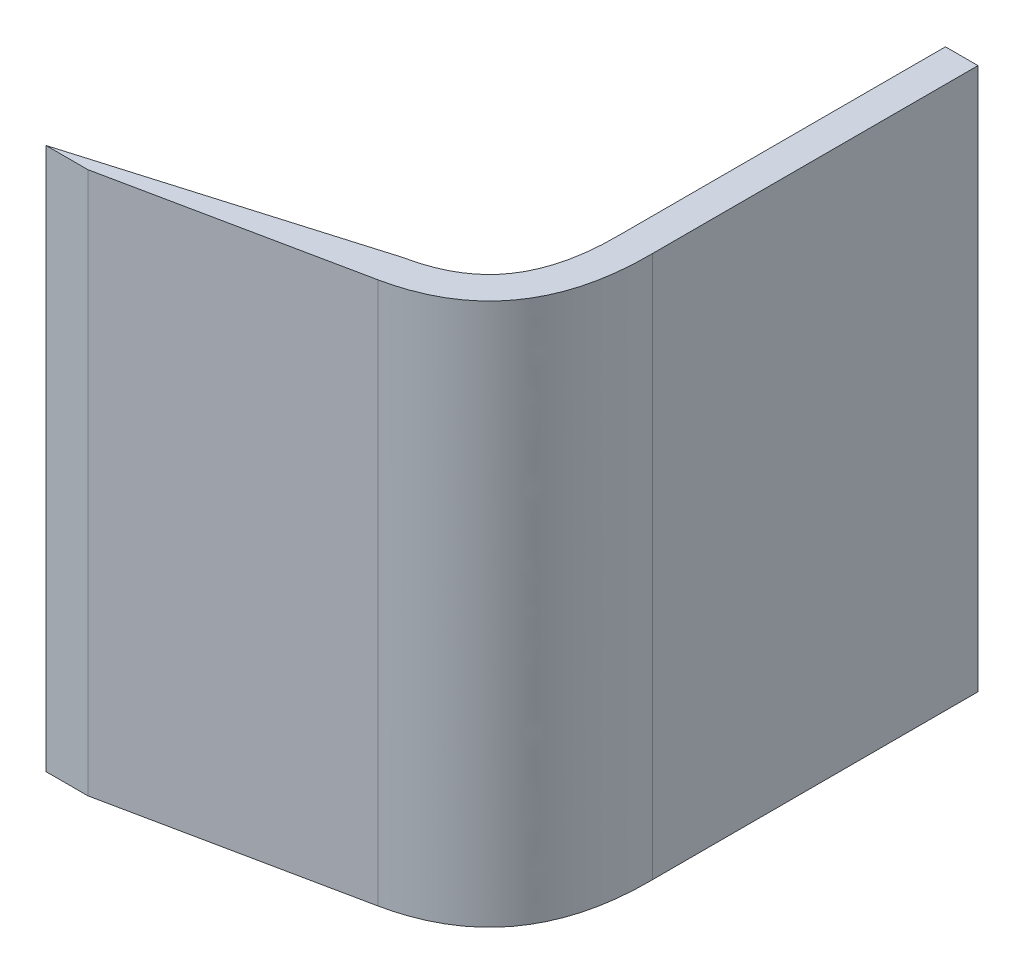
from build123d import *

# Parameters (mm, degrees)
BOSS_EXTRUDE1_DEPTH = 50


with BuildPart() as part:
    # Sketch1 → Boss-Extrude1 (new body)
    with BuildSketch(Plane(origin=(0, 0, 0), x_dir=(1, 0, 0), z_dir=(0, 1, 0))):
        Polygon((0, 30), (0, 0), (0.000186337, -0.03343628), (3, 0), (3, 30), align=None)
        with BuildLine():
            Line((0.000186337, -0.03343628), (3, 0))
            add(Edge.make_bspline(
                [(3, 0), (3.139918652, -12.553127515), (-7.554025616, -14.764008615)],
                knots=[0, 0, 0, 1, 1, 1], degree=2))
            Line((-7.554025616, -14.764008615), (-29.724787296, -19.341198123))
            Line((-29.724787296, -19.341198123), (-33.586790943, -19.341198123))
            Line((-33.586790943, -19.341198123), (-8.16140534, -11.826136958))
            add(Edge.make_bspline(
                [(0.000186337, -0.03343628), (0.005239929, -0.486831056), (-0.009475768, -1.417335062), (-0.137351147, -3.087884204), (-0.471550564, -4.947811199), (-1.116797216, -6.782204669), (-1.973725508, -8.269549477), (-3.042888675, -9.477251715), (-4.37173122, -10.472028768), (-5.764833241, -11.143024266), (-7.059525511, -11.570636997), (-7.798848397, -11.751181425), (-8.16140534, -11.826136958)],
                knots=[0, 0, 0, 0, 0.0625, 0.125, 0.25, 0.375, 0.5, 0.625, 0.75, 0.875, 0.9375, 1, 1, 1, 1], degree=3))
        make_face()
    extrude(amount=BOSS_EXTRUDE1_DEPTH)


solid = part.part
